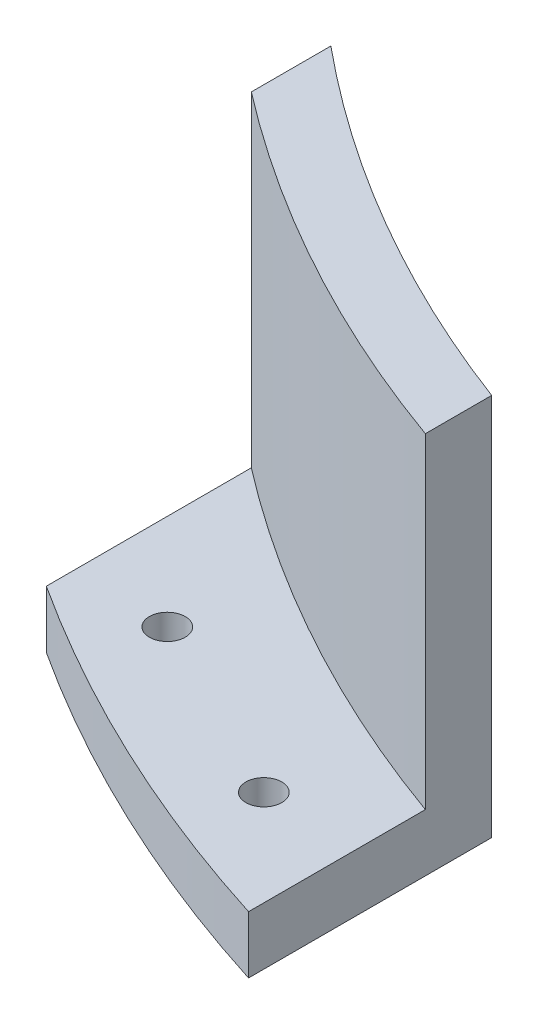
from build123d import *

# Parameters (mm, degrees)
BOSS_EXTRUDE1_DEPTH = 50.8
CUT_EXTRUDE1_START  = -43.18
SKETCH2_R           = 209.55
SKETCH2_R_2         = 187.325
CUT_EXTRUDE1_DEPTH  = 43.18
SKETCH3_R           = 2.38125
CUT_EXTRUDE2_DEPTH  = 43.18


with BuildPart() as part:
    # Sketch1 → Boss-Extrude1 (new body)
    with BuildSketch(Plane(origin=(0, 0, 0), x_dir=(1, 0, 0), z_dir=(0, 1, 0))):
        with BuildLine():
            Line((-63.233720515, -199.781628509), (-63.233720515, -167.533762239))
            ThreePointArc((-63.233720515, -167.533762239), (-89.849960422, -154.896899621), (-114.033720515, -138.066561793))
            Line((-114.033720515, -138.066561793), (-114.033720515, -175.805327239))
            ThreePointArc((-114.033720515, -175.805327239), (-89.440774639, -189.503430924), (-63.233720515, -199.781628509))
        make_face()
    extrude(amount=BOSS_EXTRUDE1_DEPTH)

    # Sketch2 → Cut-Extrude1 (cut)
    with BuildSketch(Plane(origin=(0, 50.8, 0), x_dir=(1, 0, 0), z_dir=(0, 1, 0)).offset(CUT_EXTRUDE1_START)):
        Circle(SKETCH2_R)
        Circle(SKETCH2_R_2, mode=Mode.SUBTRACT)
    extrude(amount=CUT_EXTRUDE1_DEPTH, mode=Mode.SUBTRACT)

    # Sketch3 → Cut-Extrude2 (cut)
    with BuildSketch(Plane(origin=(0, 7.62, 0), x_dir=(1, 0, 0), z_dir=(0, 1, 0))):
        with Locations(Location((-101.333720515, -172.457176457, 0), (0, 0, 270))):
            Circle(SKETCH3_R)
        with Locations(Location((-75.933720515, -185.051535291, 0), (0, 0, 270))):
            Circle(SKETCH3_R)
    extrude(amount=-CUT_EXTRUDE2_DEPTH, mode=Mode.SUBTRACT)


solid = part.part
